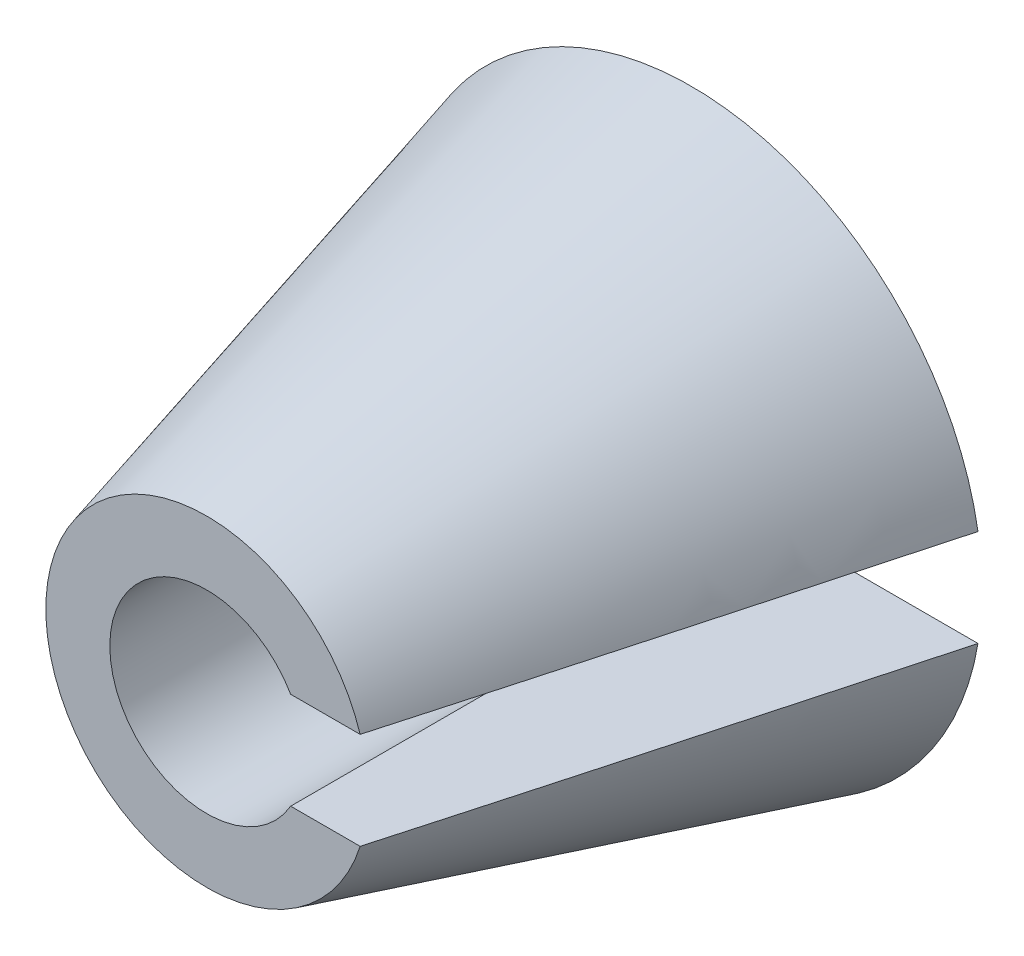
from build123d import *

# Parameters (mm, degrees)
SKETCH1_R           = 6
BOSS_EXTRUDE1_DEPTH = 10
BOSS_EXTRUDE1_TAPER = 15
SKETCH2_R           = 2
CUT_EXTRUDE1_DEPTH  = 14.114877049
SKETCH3_W           = 4.267949192
SKETCH3_H           = 2
CUT_EXTRUDE2_DEPTH  = 14.114877049


with BuildPart() as part:
    # Sketch1 → Boss-Extrude1 (new body)
    with BuildSketch(Plane.XY):
        Circle(SKETCH1_R)
    extrude(amount=BOSS_EXTRUDE1_DEPTH, taper=BOSS_EXTRUDE1_TAPER)

    # Sketch2 → Cut-Extrude1 (cut, through all)
    with BuildSketch(Plane(origin=(0, 0, 0), x_dir=(-1, 0, 0), z_dir=(0, 0, -1))):
        Circle(SKETCH2_R)
    extrude(amount=-CUT_EXTRUDE1_DEPTH, mode=Mode.SUBTRACT)

    # Sketch3 → Cut-Extrude2 (cut, through all)
    with BuildSketch(Plane(origin=(0, 0, 0), x_dir=(-1, 0, 0), z_dir=(0, 0, -1))):
        with Locations((-3.866025404, 0)):
            Rectangle(SKETCH3_W, SKETCH3_H)
    extrude(amount=-CUT_EXTRUDE2_DEPTH, mode=Mode.SUBTRACT)


solid = part.part
